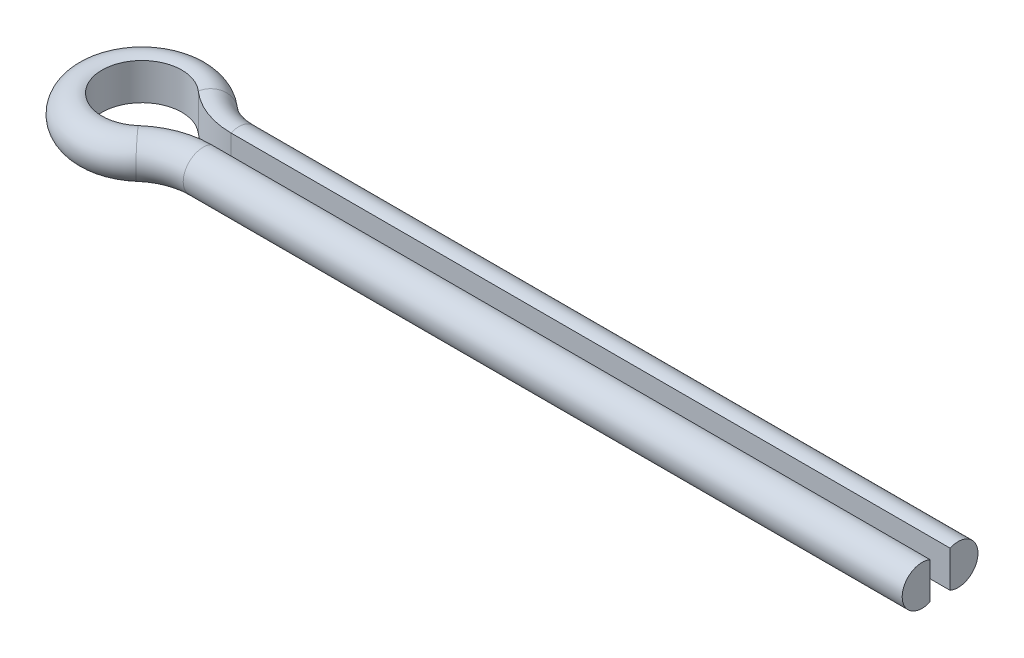
from build123d import *


with BuildPart() as part:
    # Sweep2: sweep along a path in Sketch2
    with BuildLine(Plane(origin=(0, 0, 0), x_dir=(1, 0, 0), z_dir=(0, 1, 0))) as sweep2_path:
        Line((0, 0), (-90.078432584, 0))
        ThreePointArc((-90.078432584, 0), (-93.613966489, -0.645856533), (-96.692810861, -2.5))
        ThreePointArc((-96.692810861, -2.5), (-105, 1.25), (-96.692810861, 5))
        ThreePointArc((-96.692810861, 5), (-93.613966489, 3.145856533), (-90.078432584, 2.5))
        Line((-90.078432584, 2.5), (0, 2.5))
    # Sketch11 → Sweep2 (sweep)
    with BuildSketch(Plane(origin=(0, 0, 0), x_dir=(0, 0, -1), z_dir=(1, 0, 0))):
        with BuildLine():
            Line((0, -2.291287847), (0, 2.291287847))
            ThreePointArc((0, 2.291287847), (-3.5, 0), (0, -2.291287847))
        make_face()
    sweep(path=sweep2_path.line)


solid = part.part
